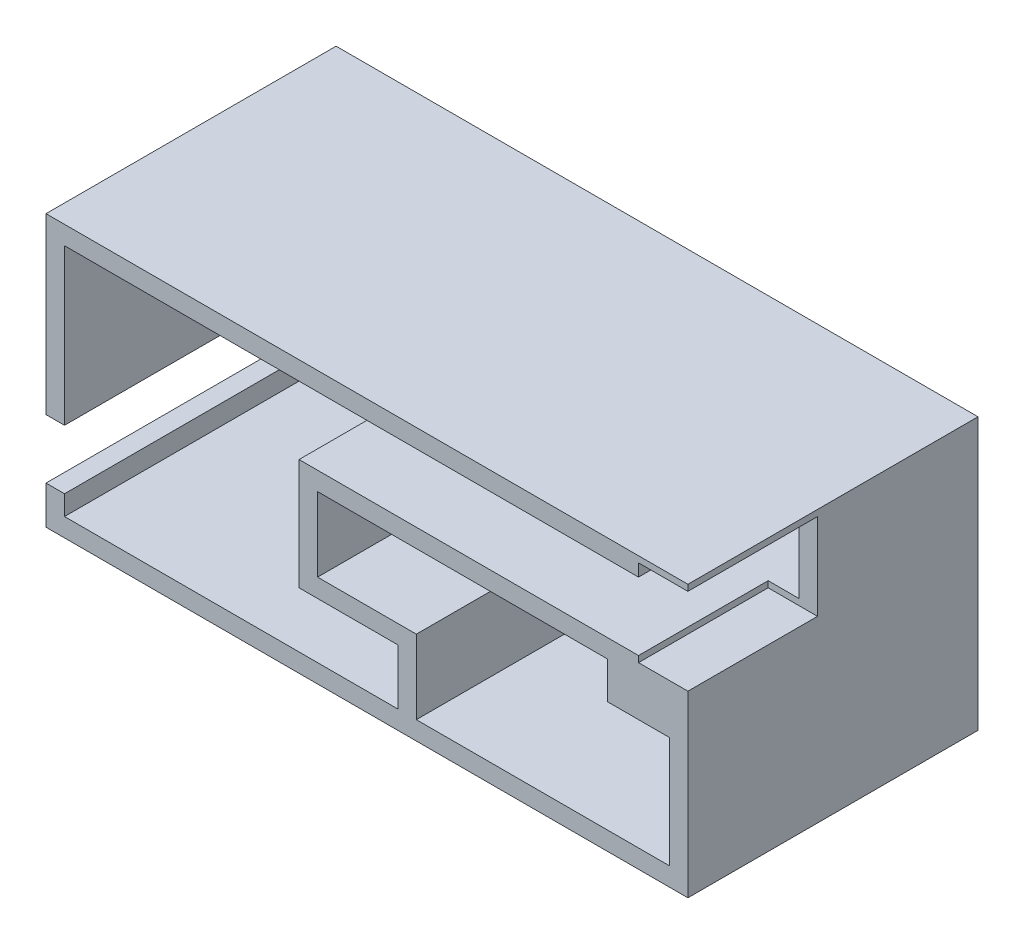
from build123d import *

# Parameters (mm, degrees)
SKETCH1_W           = 52
SKETCH1_H           = 22
BOSS_EXTRUDE1_DEPTH = 1.5
SKETCH2_W           = 52
SKETCH2_H           = 22
BOSS_EXTRUDE2_DEPTH = 22
CUT_EXTRUDE1_DEPTH  = 5
SKETCH6_W           = 10.5
SKETCH6_H           = 7
CUT_EXTRUDE2_DEPTH  = 4


with BuildPart() as part:
    # Sketch1 → Boss-Extrude1 (new body)
    with BuildSketch(Plane.XY):
        with Locations((6.718487395, 11)):
            Rectangle(SKETCH1_W, SKETCH1_H)
    extrude(amount=BOSS_EXTRUDE1_DEPTH)

    # Sketch2 → Boss-Extrude2 (add)
    with BuildSketch(Plane.XY.offset(1.5)):
        with Locations((6.718487395, 11)):
            Rectangle(SKETCH2_W, SKETCH2_H)
        Polygon((-17.781512605, 20.5), (-17.781512605, 1.5), (9.218487395, 1.5), (9.218487395, 6), (1.218487395, 6), (1.218487395, 15), (31.218487395, 15), (31.218487395, 20.5), align=None, mode=Mode.SUBTRACT)
        Polygon((31.218487395, 1.5), (31.218487395, 10.5), (26.218487395, 10.5), (26.218487395, 13.5), (2.718487395, 13.5), (2.718487395, 7.5), (10.718487395, 7.5), (10.718487395, 1.5), align=None, mode=Mode.SUBTRACT)
    extrude(amount=BOSS_EXTRUDE2_DEPTH)

    # Sketch3 → Cut-Extrude1 (cut)
    with BuildSketch(Plane.ZY.offset(19.281512605)):
        Polygon((5.75, 3.1), (17.75, 3.1), (23.5, 3.1), (23.5, 7.9), (17.75, 7.9), (5.75, 7.9), align=None)
    extrude(amount=-CUT_EXTRUDE1_DEPTH, mode=Mode.SUBTRACT)

    # Sketch6 → Cut-Extrude2 (cut)
    with BuildSketch(Plane(origin=(32.718487395, 0, 0), x_dir=(0, 0, -1), z_dir=(1, 0, 0))):
        with Locations((-18.25, 18)):
            Rectangle(SKETCH6_W, SKETCH6_H)
    extrude(amount=-CUT_EXTRUDE2_DEPTH, mode=Mode.SUBTRACT)


solid = part.part
